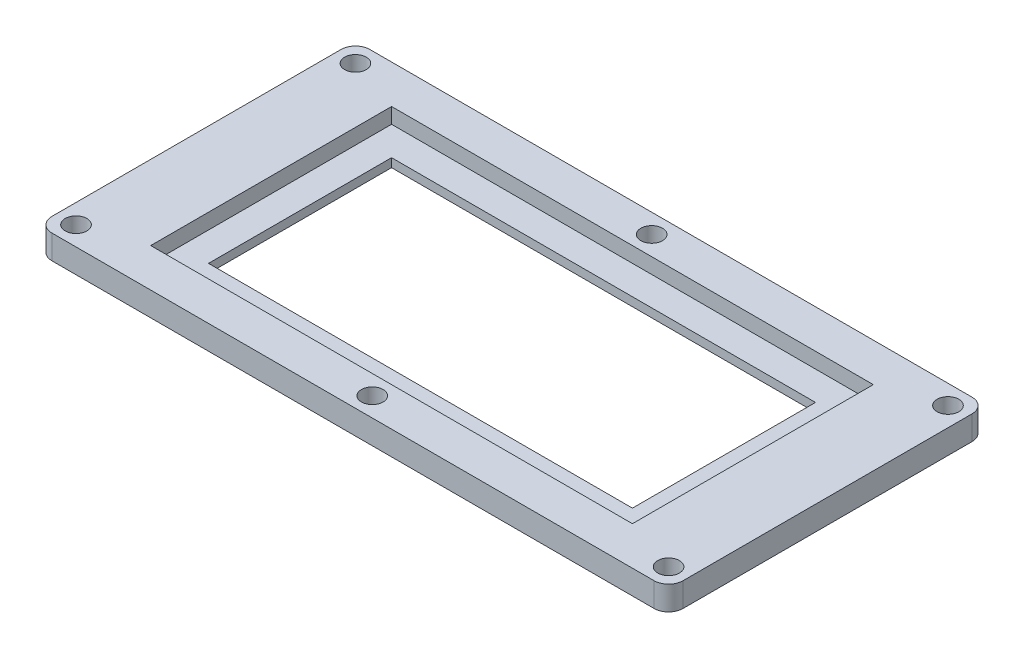
from build123d import *

# Parameters (mm, degrees)
SKETCH1_W           = 131
SKETCH1_H           = 66
BOSS_EXTRUDE1_DEPTH = 5
FILLET1_R           = 3
SKETCH2_R           = 2.25
CUT_EXTRUDE1_DEPTH  = 74.513604183
SKETCH3_W           = 100
SKETCH3_H           = 50
CUT_EXTRUDE2_DEPTH  = 3.2
SKETCH4_W           = 88
SKETCH4_H           = 38
CUT_EXTRUDE3_DEPTH  = 74.413145962


with BuildPart() as part:
    # Sketch1 → Boss-Extrude1 (new body)
    with BuildSketch(Plane(origin=(0, 0, 0), x_dir=(1, 0, 0), z_dir=(0, 1, 0))):
        Rectangle(SKETCH1_W, SKETCH1_H)
    extrude(amount=BOSS_EXTRUDE1_DEPTH)

    # Fillet1
    fillet1_edges = [part.edges().sort_by_distance(p)[0] for p in [
        (65.5, 2.5, 33),
        (-65.5, 2.5, 33),
        (-65.5, 2.5, -33),
        (65.5, 2.5, -33),
    ]]
    fillet(fillet1_edges, radius=FILLET1_R)

    # Sketch2 → Cut-Extrude1 (cut, through all)
    with BuildSketch(Plane(origin=(0, 5, 0), x_dir=(1, 0, 0), z_dir=(0, 1, 0))):
        with Locations(Location((-61.5, 29, 0), (0, 0, 270))):
            Circle(SKETCH2_R)
        with Locations(Location((61.5, 29, 0), (0, 0, 270))):
            Circle(SKETCH2_R)
        with Locations(Location((61.5, -29, 0), (0, 0, 270))):
            Circle(SKETCH2_R)
        with Locations(Location((-61.5, -29, 0), (0, 0, 270))):
            Circle(SKETCH2_R)
        with Locations(Location((0, 29, 0), (0, 0, 270))):
            Circle(SKETCH2_R)
        with Locations(Location((0, -29, 0), (0, 0, 270))):
            Circle(SKETCH2_R)
    extrude(amount=-CUT_EXTRUDE1_DEPTH, mode=Mode.SUBTRACT)

    # Sketch3 → Cut-Extrude2 (cut)
    with BuildSketch(Plane(origin=(0, 5, 0), x_dir=(1, 0, 0), z_dir=(0, 1, 0))):
        Rectangle(SKETCH3_W, SKETCH3_H)
    extrude(amount=-CUT_EXTRUDE2_DEPTH, mode=Mode.SUBTRACT)

    # Sketch4 → Cut-Extrude3 (cut, through all)
    with BuildSketch(Plane(origin=(0, 1.8, 0), x_dir=(1, 0, 0), z_dir=(0, 1, 0))):
        Rectangle(SKETCH4_W, SKETCH4_H)
    extrude(amount=-CUT_EXTRUDE3_DEPTH, mode=Mode.SUBTRACT)


solid = part.part
